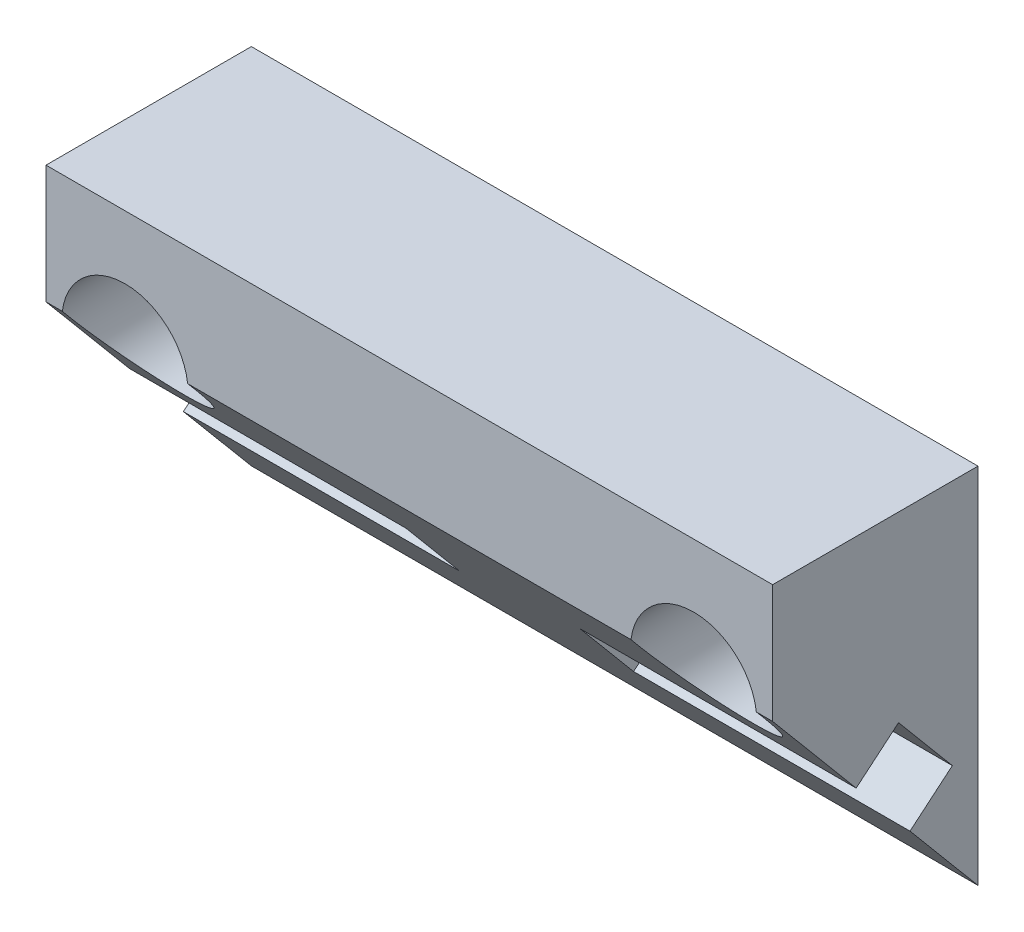
from build123d import *

# Parameters (mm, degrees)
EX_BODY_DEPTH       = 46
SK_SKINBOLTS_R      = 2.25
CUT_SKINBOLTS_DEPTH = 13
SK_BOLTHEADS_R      = 4
CUT_BOLTHEADS_DEPTH = 7
CUT_PLUGL_DEPTH     = 17.5
CUT_PLUGR_DEPTH     = 17.5


with BuildPart() as part:
    # SK_Body → EX_Body (new body)
    with BuildSketch(Plane(origin=(-23, 0, 0), x_dir=(0, 0, -1), z_dir=(1, 0, 0))):
        Polygon((0, -14.989146791), (-13, 0.503649913), (-13, 8), (0, 8), align=None)
    extrude(amount=EX_BODY_DEPTH)

    # SK_SkinBolts → CUT_SkinBolts (cut)
    with BuildSketch(Plane.XY):
        with Locations((18, 0)):
            Circle(SK_SKINBOLTS_R)
        with Locations((-18, 0)):
            Circle(SK_SKINBOLTS_R)
    extrude(amount=CUT_SKINBOLTS_DEPTH, mode=Mode.SUBTRACT)

    # SK_BoltHeads → CUT_BoltHeads (cut)
    with BuildSketch(Plane.XY.offset(6)):
        with Locations((18, 0)):
            Circle(SK_BOLTHEADS_R)
        with Locations((-18, 0)):
            Circle(SK_BOLTHEADS_R)
    extrude(amount=CUT_BOLTHEADS_DEPTH, mode=Mode.SUBTRACT)

    # SK_PlugL → CUT_PlugL (cut)
    with BuildSketch(Plane(origin=(5.5, 0, 0), x_dir=(0, 0, -1), z_dir=(1, 0, 0))):
        Polygon((-4.304897282, -9.858769989), (-7.711671614, -5.798734441), (-5.030516063, -3.548977807), (-1.623741731, -7.609013355), align=None)
    extrude(amount=CUT_PLUGL_DEPTH, mode=Mode.SUBTRACT)

    # SK_PlugR → CUT_PlugR (cut)
    with BuildSketch(Plane(origin=(-5.5, 0, 0), x_dir=(0, 0, -1), z_dir=(1, 0, 0))):
        Polygon((-4.304897282, -9.858769989), (-7.711671614, -5.798734441), (-5.030516063, -3.548977807), (-1.623741731, -7.609013355), align=None)
    extrude(amount=-CUT_PLUGR_DEPTH, mode=Mode.SUBTRACT)


solid = part.part
